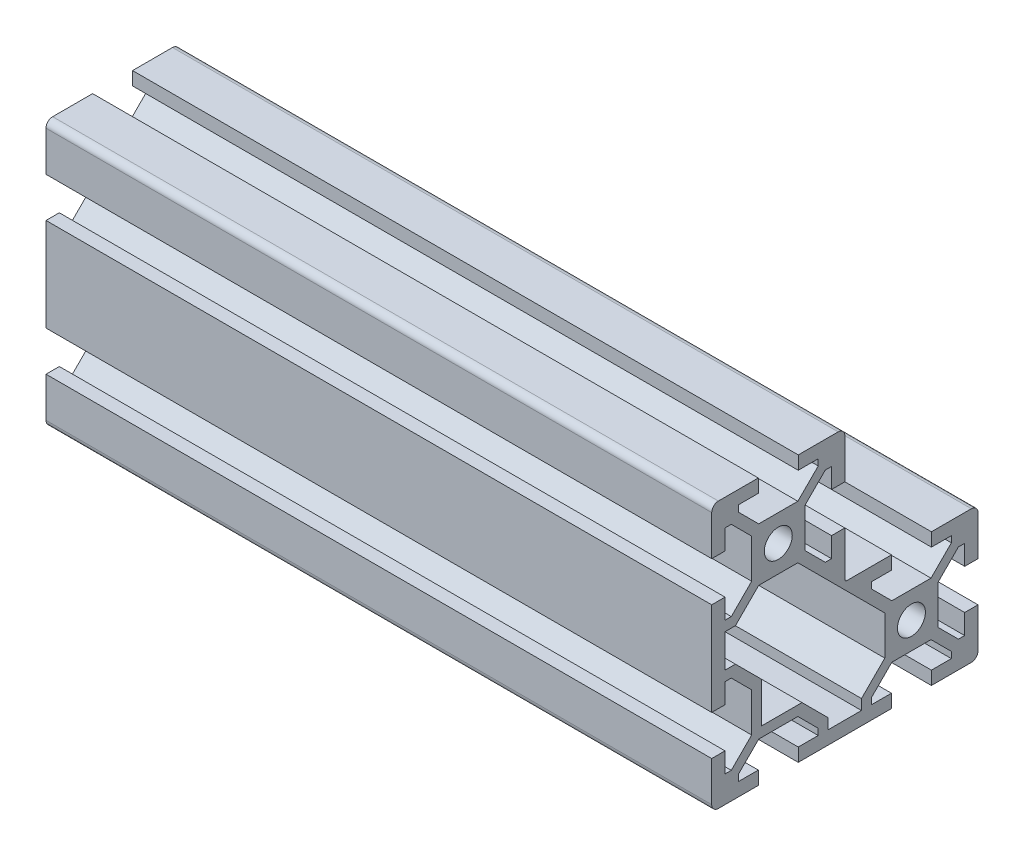
from build123d import *

# Parameters (mm, degrees)
SKETCH1_R           = 2.1
BOSS_EXTRUDE1_DEPTH = 100


with BuildPart() as part:
    # Sketch1 → Boss-Extrude1 (new body)
    with BuildSketch(Plane(origin=(0, 0, 0), x_dir=(0, 0, -1), z_dir=(1, 0, 0))):
        with BuildLine():
            Line((-13, 18), (-13, 20))
            Line((-13, 20), (-19, 20))
            ThreePointArc((-19, 20), (-19.707106781, 19.707106781), (-20, 19))
            Line((-20, 19), (-20, 13))
            Line((-20, 13), (-18, 13))
            Line((-18, 13), (-18, 16))
            Line((-18, 16), (-17.060660172, 16))
            Line((-17.060660172, 16), (-14, 12.939339828))
            Line((-14, 12.939339828), (-14, 7.060660172))
            Line((-14, 7.060660172), (-17.060660172, 4))
            Line((-17.060660172, 4), (-18, 4))
            Line((-18, 4), (-18, 7))
            Line((-18, 7), (-20, 7))
            Line((-20, 7), (-20, -7))
            Line((-20, -7), (-18, -7))
            Line((-18, -7), (-18, -4))
            Line((-18, -4), (-17.060660172, -4))
            Line((-17.060660172, -4), (-14, -7.060660172))
            Line((-14, -7.060660172), (-14, -12.939339828))
            Line((-14, -12.939339828), (-17.060660172, -16))
            Line((-17.060660172, -16), (-18, -16))
            Line((-18, -16), (-18, -13))
            Line((-18, -13), (-20, -13))
            Line((-20, -13), (-20, -19))
            ThreePointArc((-20, -19), (-19.707106781, -19.707106781), (-19, -20))
            Line((-19, -20), (-13, -20))
            Line((-13, -20), (-13, -18))
            Line((-13, -18), (-16, -18))
            Line((-16, -18), (-16, -17.060660172))
            Line((-16, -17.060660172), (-12.939339828, -14))
            Line((-12.939339828, -14), (-7.060660172, -14))
            Line((-7.060660172, -14), (-4, -17.060660172))
            Line((-4, -17.060660172), (-4, -18))
            Line((-4, -18), (-7, -18))
            Line((-7, -18), (-7, -20))
            Line((-7, -20), (7, -20))
            Line((7, -20), (7, -18))
            Line((7, -18), (4, -18))
            Line((4, -18), (4, -17.060660172))
            Line((4, -17.060660172), (7.060660172, -14))
            Line((7.060660172, -14), (12.939339828, -14))
            Line((12.939339828, -14), (16, -17.060660172))
            Line((16, -17.060660172), (16, -18))
            Line((16, -18), (13, -18))
            Line((13, -18), (13, -20))
            Line((13, -20), (19, -20))
            ThreePointArc((19, -20), (19.707106781, -19.707106781), (20, -19))
            Line((20, -19), (20, -13))
            Line((20, -13), (18, -13))
            Line((18, -13), (18, -16))
            Line((18, -16), (17.060660172, -16))
            Line((17.060660172, -16), (14, -12.939339828))
            Line((14, -12.939339828), (14, -7.060660172))
            Line((14, -7.060660172), (17.060660172, -4))
            Line((17.060660172, -4), (18, -4))
            Line((18, -4), (18, -7))
            Line((18, -7), (20, -7))
            Line((20, -7), (20, -1))
            ThreePointArc((20, -1), (19.707106781, -0.292893219), (19, 0))
            Line((19, 0), (13, 0))
            Line((13, 0), (13, -2))
            Line((13, -2), (16, -2))
            Line((16, -2), (16, -2.939339828))
            Line((16, -2.939339828), (12.939339828, -6))
            Line((12.939339828, -6), (7.060660172, -6))
            Line((7.060660172, -6), (4, -2.939339828))
            Line((4, -2.939339828), (4, -2))
            Line((4, -2), (7, -2))
            Line((7, -2), (7, 0))
            Line((7, 0), (0.3, 0))
            ThreePointArc((0.3, 0), (0.087867966, 0.087867966), (0, 0.3))
            Line((0, 0.3), (0, 7))
            Line((0, 7), (-2, 7))
            Line((-2, 7), (-2, 4))
            Line((-2, 4), (-2.939339828, 4))
            Line((-2.939339828, 4), (-6, 7.060660172))
            Line((-6, 7.060660172), (-6, 12.939339828))
            Line((-6, 12.939339828), (-2.939339828, 16))
            Line((-2.939339828, 16), (-2, 16))
            Line((-2, 16), (-2, 13))
            Line((-2, 13), (0, 13))
            Line((0, 13), (0, 19))
            ThreePointArc((0, 19), (-0.292893219, 19.707106781), (-1, 20))
            Line((-1, 20), (-7, 20))
            Line((-7, 20), (-7, 18))
            Line((-7, 18), (-4, 18))
            Line((-4, 18), (-4, 17.060660172))
            Line((-4, 17.060660172), (-7.060660172, 14))
            Line((-7.060660172, 14), (-12.939339828, 14))
            Line((-12.939339828, 14), (-16, 17.060660172))
            Line((-16, 17.060660172), (-16, 18))
            Line((-16, 18), (-13, 18))
        make_face()
        with Locations((10, -10)):
            Circle(SKETCH1_R, mode=Mode.SUBTRACT)
        with Locations((-10, 10)):
            Circle(SKETCH1_R, mode=Mode.SUBTRACT)
        Polygon((6, -7.060660172), (-7.060660172, 6), (-12.939339828, 6), (-16.439339828, 2.5), (-18, 2.5), (-18, -2.5), (-16.439339828, -2.5), (-12.5, -6.439339828), (-12.5, -12.5), (-6.439339828, -12.5), (-2.5, -16.439339828), (-2.5, -18), (2.5, -18), (2.5, -16.439339828), (6, -12.939339828), align=None, mode=Mode.SUBTRACT)
    extrude(amount=BOSS_EXTRUDE1_DEPTH)


solid = part.part
